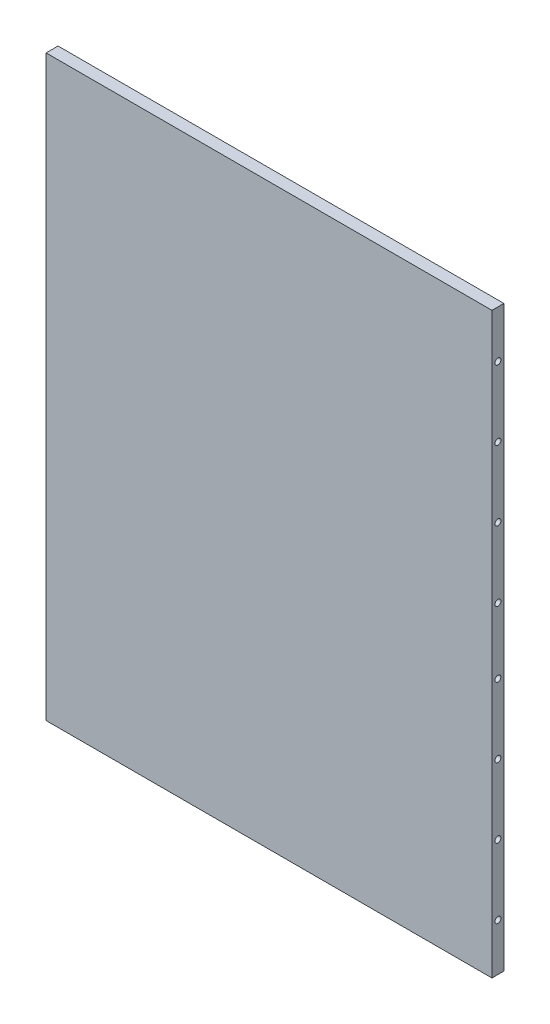
from build123d import *

# Parameters (mm, degrees)
CROQUIS1_W              = 448
CROQUIS1_H              = 581
SALIENTE_EXTRUIR2_DEPTH = 6
CORTAR_EXTRUIR2_START   = 225
CROQUIS3_R              = 3
CORTAR_EXTRUIR2_DEPTH   = 27
CORTAR_EXTRUIR3_START   = 290
CROQUIS4_R              = 3
CORTAR_EXTRUIR3_DEPTH   = 27


with BuildPart() as part:
    # Croquis1 → Saliente-Extruir2 (new, symmetric)
    with BuildSketch(Plane.XY):
        Rectangle(CROQUIS1_W, CROQUIS1_H)
    extrude(amount=SALIENTE_EXTRUIR2_DEPTH, both=True)

    # Croquis3 → Cortar-Extruir2 (cut)
    with BuildSketch(Plane(origin=(0, 0, 0), x_dir=(0, 0, -1), z_dir=(1, 0, 0)).offset(CORTAR_EXTRUIR2_START)):
        with Locations((0, 243)):
            Circle(CROQUIS3_R)
        with Locations((0, 173)):
            Circle(CROQUIS3_R)
        with Locations((0, 103)):
            Circle(CROQUIS3_R)
        with Locations((0, 33)):
            Circle(CROQUIS3_R)
        with Locations(Location((0, -33, 0), (0, 0, 270))):
            Circle(CROQUIS3_R)
        with Locations(Location((0, -103, 0), (0, 0, 270))):
            Circle(CROQUIS3_R)
        with Locations(Location((0, -173, 0), (0, 0, 270))):
            Circle(CROQUIS3_R)
        with Locations(Location((0, -243, 0), (0, 0, 270))):
            Circle(CROQUIS3_R)
    cortar_extruir2 = extrude(amount=-CORTAR_EXTRUIR2_DEPTH, mode=Mode.SUBTRACT)

    # Simetría1: Cortar-Extruir2 across plane
    add(cortar_extruir2.mirror(Plane(origin=(0, 0, 0), x_dir=(0, 0, 1), z_dir=(1, 0, 0))), mode=Mode.SUBTRACT)

    # Croquis4 → Cortar-Extruir3 (cut)
    with BuildSketch(Plane(origin=(0, 0, 0), x_dir=(1, 0, 0), z_dir=(0, 1, 0)).offset(CORTAR_EXTRUIR3_START)):
        with Locations(Location((-176.5, 0, 0), (0, 0, 270))):
            Circle(CROQUIS4_R)
        with Locations(Location((-106.5, 0, 0), (0, 0, 270))):
            Circle(CROQUIS4_R)
        with Locations(Location((-36.5, 0, 0), (0, 0, 270))):
            Circle(CROQUIS4_R)
        with Locations(Location((36.5, 0, 0), (0, 0, 90))):
            Circle(CROQUIS4_R)
        with Locations(Location((106.5, 0, 0), (0, 0, 90))):
            Circle(CROQUIS4_R)
        with Locations(Location((176.5, 0, 0), (0, 0, 90))):
            Circle(CROQUIS4_R)
    cortar_extruir3 = extrude(amount=-CORTAR_EXTRUIR3_DEPTH, mode=Mode.SUBTRACT)

    # Simetría2: Cortar-Extruir3 across plane
    add(cortar_extruir3.mirror(Plane.ZX), mode=Mode.SUBTRACT)


solid = part.part
